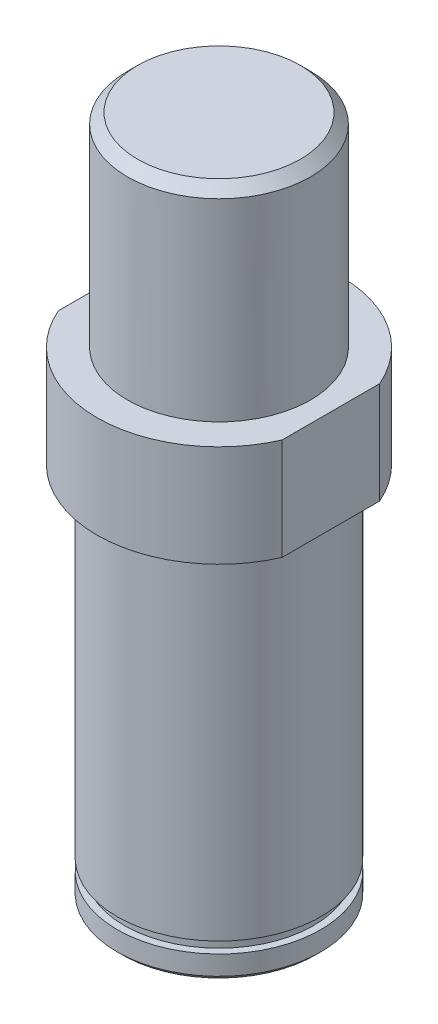
from build123d import *

# Parameters (mm, degrees)
CHAMFER_1_SIZE      = 1
CUT_EXTRUDE_1_DEPTH = 37.221540553
SKETCH_3_R          = 10
EXTRUDE_1_DEPTH     = 15
CHAMFER_2_SIZE      = 0.5
SKETCH_7_W          = 0.7
SKETCH_7_H          = 1.1


with BuildPart() as part:
    # 草图1 → 旋转1 (revolve)
    with BuildSketch(Plane.XY, mode=Mode.PRIVATE) as revolve_1_sk:
        Polygon((0, 0), (10, 0), (10, 1.992934229), (10, 22), (12, 22), (12, 32), (9, 32), (9, 52), (0, 52), align=None)
    revolve(revolve_1_sk.sketch.rotate(Axis((0, 0, 0), (0, 1, 0)), 90), axis=Axis((0, 0, 0), (0, 1, 0)))

    # 倒角1
    chamfer_1_edges = [part.edges().sort_by_distance(p)[0] for p in [
        (0, 52, 9),
    ]]
    chamfer(chamfer_1_edges, length=CHAMFER_1_SIZE)

    # 草图2 → 切除-拉伸1 (cut, through all)
    with BuildSketch(Plane(origin=(0, 32, 0), x_dir=(1, 0, 0), z_dir=(0, 1, 0))):
        with BuildLine():
            Line((-11, -4.795831523), (-11, 4.795831523))
            ThreePointArc((-11, 4.795831523), (-12, 0), (-11, -4.795831523))
        make_face()
        with BuildLine():
            ThreePointArc((12, 0), (11.747340124, 2.449489743), (11, 4.795831523))
            Line((11, 4.795831523), (11, -4.795831523))
            ThreePointArc((11, -4.795831523), (11.747340124, -2.449489743), (12, 0))
        make_face()
    extrude(amount=-CUT_EXTRUDE_1_DEPTH, mode=Mode.SUBTRACT)

    # 草图3 → 凸台-拉伸1 (add)
    with BuildSketch(Plane.XZ):
        with Locations(Location((0, 0, 0), (0, 0, 270))):
            Circle(SKETCH_3_R)
    extrude(amount=EXTRUDE_1_DEPTH)

    # 倒角2
    chamfer_2_edges = [part.edges().sort_by_distance(p)[0] for p in [
        (0, -15, 10),
    ]]
    chamfer(chamfer_2_edges, length=CHAMFER_2_SIZE)

    # 草图7 → 切除-旋转1 (revolve, cut)
    with BuildSketch(Plane(origin=(0, 0, 0), x_dir=(0, 0, -1), z_dir=(1, 0, 0))):
        with Locations((9.65, -12.05)):
            Rectangle(SKETCH_7_W, SKETCH_7_H)
    revolve(axis=Axis((0, 52, 0), (0, -1, 0)), mode=Mode.SUBTRACT)


solid = part.part
